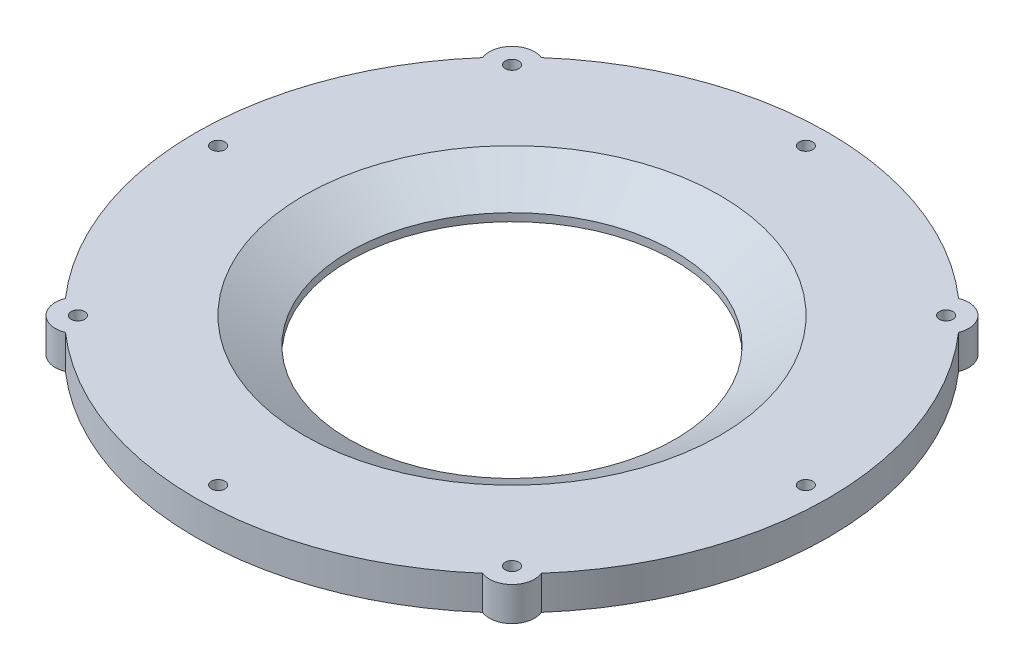
from build123d import *

# Parameters (mm, degrees)
SKETCH1_R           = 1.905
BOSS_EXTRUDE1_DEPTH = 9.525
SKETCH2_R           = 45.72
CUT_EXTRUDE1_DEPTH  = 12.7
SKETCH4_R           = 1.905
CUT_EXTRUDE3_DEPTH  = 12.7
CIRPATTERN2_COUNT   = 4
SKETCH10_R          = 0.6985
CUT_EXTRUDE5_DEPTH  = 3.175
CIRPATTERN5_COUNT   = 4
CHAMFER1_SIZE       = 12.7
CHAMFER1_SIZE2      = 7.332348419


with BuildPart() as part:
    # Sketch1 → Boss-Extrude1 (new body)
    with BuildSketch(Plane(origin=(0, 0, 0), x_dir=(1, 0, 0), z_dir=(0, 1, 0))):
        with BuildLine():
            ThreePointArc((-66.860826677, 58.590441679), (-88.9, 0), (-66.860826677, -58.590441679))
            ThreePointArc((-66.860826677, -58.590441679), (-65.466067123, -65.466067123), (-58.590441679, -66.860826677))
            ThreePointArc((-58.590441679, -66.860826677), (0, -88.9), (58.590441679, -66.860826677))
            ThreePointArc((58.590441679, -66.860826677), (65.466067123, -65.466067123), (66.860826677, -58.590441679))
            ThreePointArc((66.860826677, -58.590441679), (88.9, 0), (66.860826677, 58.590441679))
            ThreePointArc((66.860826677, 58.590441679), (65.466067123, 65.466067123), (58.590441679, 66.860826677))
            ThreePointArc((58.590441679, 66.860826677), (0, 88.9), (-58.590441679, 66.860826677))
            ThreePointArc((-58.590441679, 66.860826677), (-65.466067123, 65.466067123), (-66.860826677, 58.590441679))
        make_face()
        with Locations(Location((-60.975939062, 60.975939062, 0), (0, 0, 90))):
            Circle(SKETCH1_R, mode=Mode.SUBTRACT)
        with Locations(Location((60.975939062, 60.975939062, 0), (0, 0, 90))):
            Circle(SKETCH1_R, mode=Mode.SUBTRACT)
        with Locations(Location((60.975939062, -60.975939062, 0), (0, 0, 90))):
            Circle(SKETCH1_R, mode=Mode.SUBTRACT)
        with Locations(Location((-60.975939062, -60.975939062, 0), (0, 0, 90))):
            Circle(SKETCH1_R, mode=Mode.SUBTRACT)
    extrude(amount=BOSS_EXTRUDE1_DEPTH)

    # Sketch2 → Cut-Extrude1 (cut)
    with BuildSketch(Plane(origin=(0, 9.525, 0), x_dir=(1, 0, 0), z_dir=(0, 1, 0))):
        with Locations(Location((0, 0, 0), (0, 0, 270))):
            Circle(SKETCH2_R)
    extrude(amount=-CUT_EXTRUDE1_DEPTH, mode=Mode.SUBTRACT)

    # Sketch4 → Cut-Extrude3 (cut)
    with BuildSketch(Plane(origin=(0, 9.525, 0), x_dir=(1, 0, 0), z_dir=(0, 1, 0))):
        with Locations(Location((0, 82.55, 0), (0, 0, 270))):
            Circle(SKETCH4_R)
    cut_extrude3 = extrude(amount=-CUT_EXTRUDE3_DEPTH, mode=Mode.SUBTRACT)

    # CirPattern2: Cut-Extrude3 ×4 about axis
    cirpattern2_axis = Axis((0, 0, 0), (0, 1, 0))
    for i in range(1, CIRPATTERN2_COUNT):
        add(cut_extrude3.rotate(cirpattern2_axis, i * 360 / CIRPATTERN2_COUNT), mode=Mode.SUBTRACT)

    # Sketch10 → Cut-Extrude5 (cut)
    with BuildSketch(Plane(origin=(-62.861792847, 0, -62.861792847), x_dir=(0, -1, 0), z_dir=(-0.7071067811865464, 0, -0.7071067811865488))):
        with Locations(Location((-4.826, 0, 0), (0, 0, 90))):
            Circle(SKETCH10_R)
    cut_extrude5 = extrude(amount=-CUT_EXTRUDE5_DEPTH, mode=Mode.SUBTRACT)

    # CirPattern5: Cut-Extrude5 ×4 about axis
    cirpattern5_axis = Axis((0, 0, 0), (0, 1, 0))
    for i in range(1, CIRPATTERN5_COUNT):
        add(cut_extrude5.rotate(cirpattern5_axis, i * 360 / CIRPATTERN5_COUNT), mode=Mode.SUBTRACT)

    # Chamfer1
    chamfer1_edges = [part.edges().sort_by_distance(p)[0] for p in [
        (0, 9.525, -45.72),
    ]]
    chamfer1_side = [part.faces().sort_by_distance(p)[0] for p in [
        (0, 9.525, -86.385528286),
    ]]
    chamfer(chamfer1_edges, length=CHAMFER1_SIZE, length2=CHAMFER1_SIZE2, reference=chamfer1_side[0])


solid = part.part
